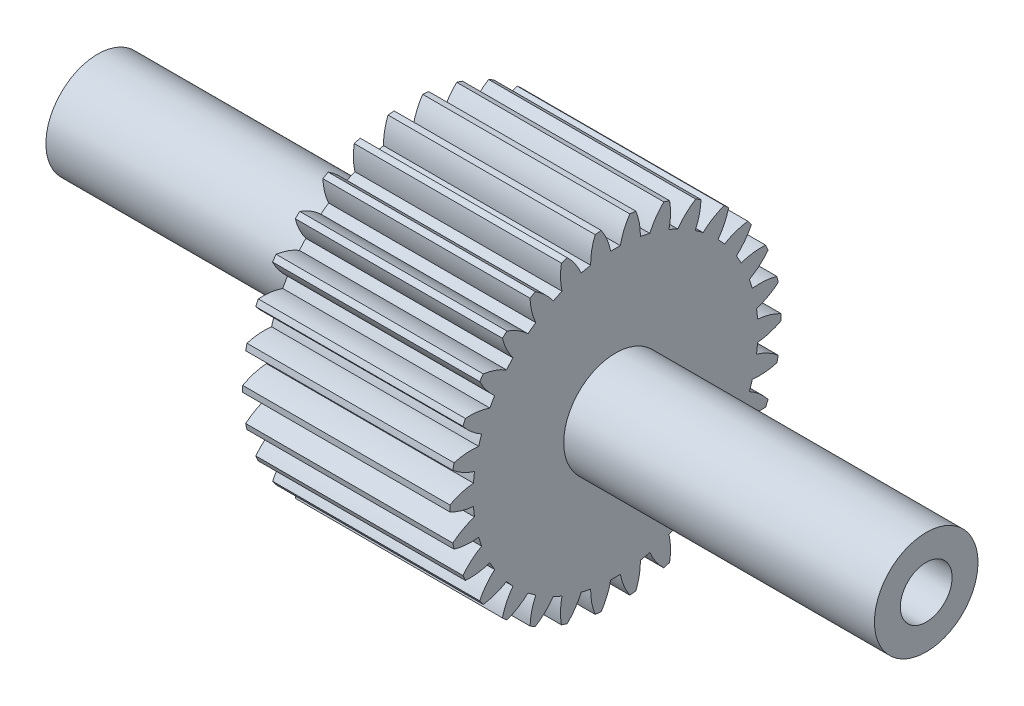
from build123d import *

# Parameters (mm, degrees)
BASPROSKE_W            = 20
BASPROSKE_H            = 16
TOOTHCUT_DEPTH         = 31.199337741
TEETHCUTS_COUNT        = 30
BORSKE_R               = 0.4
BORE_DEPTH             = 20
EXTRUDE_1_DEPTH        = 30
EXTRUDE_2_DEPTH        = 30
EXTRUDE_2_DEPTH_BACK   = 50
HOLE_WIZARD_M6_1_D     = 5
HOLE_WIZARD_M6_1_DEPTH = 15
HOLE_WIZARD_M6_1_TIP   = 1.502151548
HOLE_WIZARD_M6_2_D     = 5
HOLE_WIZARD_M6_2_DEPTH = 15
HOLE_WIZARD_M6_2_TIP   = 1.502151548


with BuildPart() as part:
    # BasProSke → Base-Revolve (revolve)
    with BuildSketch(Plane(origin=(0, 0, 0), x_dir=(1, 0, 0), z_dir=(0, 1, 0)), mode=Mode.PRIVATE) as base_revolve_sk:
        with Locations((10, 8)):
            Rectangle(BASPROSKE_W, BASPROSKE_H)
    revolve(base_revolve_sk.sketch.rotate(Axis((-10, 0, 0), (1, 0, 0)), 180), axis=Axis((-10, 0, 0), (1, 0, 0)))

    # TooCutSke → ToothCut (cut, through all)
    with BuildSketch(Plane(origin=(0, 0, 0), x_dir=(0, 0, -1), z_dir=(1, 0, 0))):
        with BuildLine():
            ThreePointArc((0.466400716, 13.741086979), (0, 13.749), (-0.466400716, 13.741086979))
            ThreePointArc((-0.466400716, 13.741086979), (-0.819142092, 14.899954875), (-1.3974676, 15.964351834))
            ThreePointArc((-1.3974676, 15.964351834), (0, 16.0254), (1.3974676, 15.964351834))
            ThreePointArc((1.3974676, 15.964351834), (0.819142092, 14.899954875), (0.466400716, 13.741086979))
        make_face()
    toothcut = extrude(amount=TOOTHCUT_DEPTH, mode=Mode.SUBTRACT)

    # TeethCuts: ToothCut ×30 about axis
    teethcuts_axis = Axis((0, 0, 0), (1, 0, 0))
    for i in range(1, TEETHCUTS_COUNT):
        add(toothcut.rotate(teethcuts_axis, i * 360 / TEETHCUTS_COUNT), mode=Mode.SUBTRACT)

    # BorSke → Bore (cut, symmetric)
    with BuildSketch(Plane(origin=(0, 0, 0), x_dir=(0, 0, -1), z_dir=(1, 0, 0))):
        with Locations(Location((0, 0, 0), (0, 0, 180))):
            Circle(BORSKE_R)
    extrude(amount=BORE_DEPTH, both=True, mode=Mode.SUBTRACT)

    # 草图1 → 凸台-拉伸1 (add)
    with BuildSketch(Plane(origin=(20, 0, 0), x_dir=(0, 0, -1), z_dir=(1, 0, 0))):
        with BuildLine():
            Line((-5, 0), (0, 0))
            Line((0, 0), (0, 5))
            ThreePointArc((0, 5), (-3.535533906, 3.535533906), (-5, 0))
        make_face()
        with BuildLine():
            Line((0, -5), (0, 0))
            Line((0, 0), (-5, 0))
            ThreePointArc((-5, 0), (-3.535533906, -3.535533906), (0, -5))
        make_face()
        with BuildLine():
            Line((0, 5), (0, 0))
            Line((0, 0), (5, 0))
            ThreePointArc((5, 0), (3.535533906, 3.535533906), (0, 5))
        make_face()
        with BuildLine():
            Line((5, 0), (0, 0))
            Line((0, 0), (0, -5))
            ThreePointArc((0, -5), (3.535533906, -3.535533906), (5, 0))
        make_face()
    extrude(amount=EXTRUDE_1_DEPTH)

    # 草图1<6> → 凸台-拉伸2 (add, two sides: drawn at the far end of the back side and taken through both)
    with BuildSketch(Plane(origin=(20, 0, 0), x_dir=(0, 0, -1), z_dir=(1, 0, 0)).offset(-EXTRUDE_2_DEPTH_BACK)):
        with BuildLine():
            Line((0, -5), (0, 0))
            Line((0, 0), (-5, 0))
            ThreePointArc((-5, 0), (-3.535533906, -3.535533906), (0, -5))
        make_face()
        with BuildLine():
            Line((5, 0), (0, 0))
            Line((0, 0), (0, -5))
            ThreePointArc((0, -5), (3.535533906, -3.535533906), (5, 0))
        make_face()
        with BuildLine():
            Line((0, 5), (0, 0))
            Line((0, 0), (5, 0))
            ThreePointArc((5, 0), (3.535533906, 3.535533906), (0, 5))
        make_face()
        with BuildLine():
            Line((-5, 0), (0, 0))
            Line((0, 0), (0, 5))
            ThreePointArc((0, 5), (-3.535533906, 3.535533906), (-5, 0))
        make_face()
    extrude(amount=EXTRUDE_2_DEPTH + EXTRUDE_2_DEPTH_BACK)

    # M6 螺纹孔1
    with Locations(Plane(origin=(50, 0, 0), x_dir=(0, 0, -1), z_dir=(1, 0, 0))):
        with Locations((0, 0)):
            Hole(HOLE_WIZARD_M6_1_D / 2, depth=HOLE_WIZARD_M6_1_DEPTH)
            with Locations((0, 0, -(HOLE_WIZARD_M6_1_DEPTH + HOLE_WIZARD_M6_1_TIP / 2))):  # 118° drill point
                Cone(0, HOLE_WIZARD_M6_1_D / 2, HOLE_WIZARD_M6_1_TIP, mode=Mode.SUBTRACT)

    # M6 螺纹孔2
    with Locations(Plane.ZY.offset(30)):
        with Locations((0, 0)):
            Hole(HOLE_WIZARD_M6_2_D / 2, depth=HOLE_WIZARD_M6_2_DEPTH)
            with Locations((0, 0, -(HOLE_WIZARD_M6_2_DEPTH + HOLE_WIZARD_M6_2_TIP / 2))):  # 118° drill point
                Cone(0, HOLE_WIZARD_M6_2_D / 2, HOLE_WIZARD_M6_2_TIP, mode=Mode.SUBTRACT)


solid = part.part
